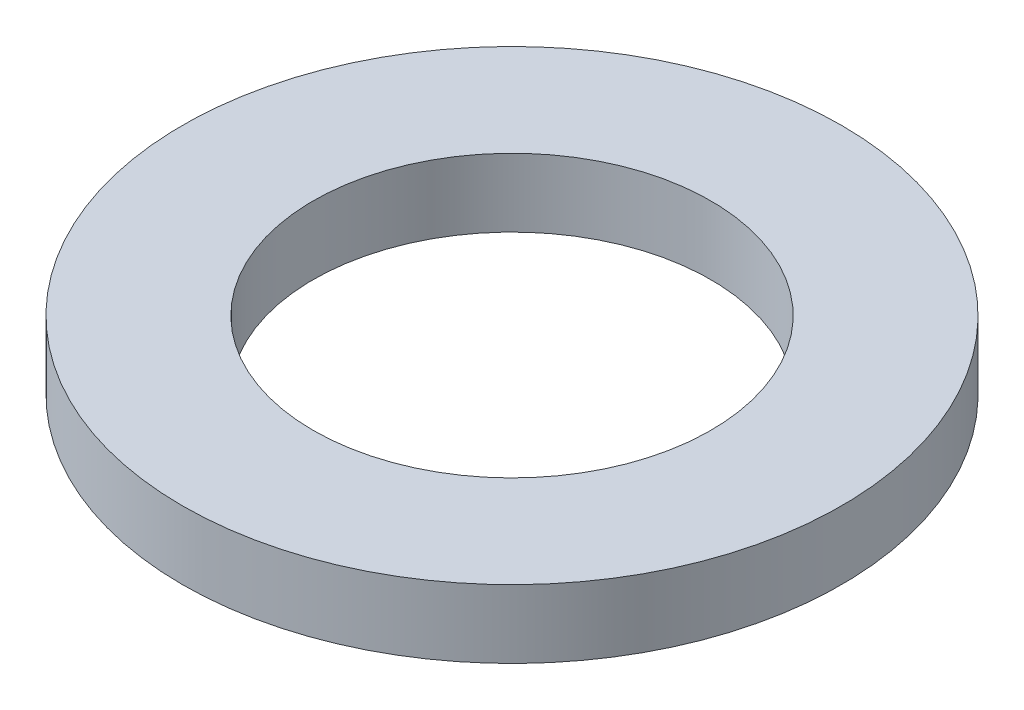
from build123d import *

# Parameters (mm, degrees)
SKETCH1_R           = 9.655
SKETCH1_R_2         = 5.825
BOSS_EXTRUDE1_DEPTH = 2


with BuildPart() as part:
    # Sketch1 → Boss-Extrude1 (new body)
    with BuildSketch(Plane(origin=(0, 0, 0), x_dir=(1, 0, 0), z_dir=(0, 1, 0))):
        with Locations(Location((0, 0, 0), (0, 0, 270))):
            Circle(SKETCH1_R)
        with Locations(Location((0, 0, 0), (0, 0, 270))):
            Circle(SKETCH1_R_2, mode=Mode.SUBTRACT)
    extrude(amount=BOSS_EXTRUDE1_DEPTH)


solid = part.part
